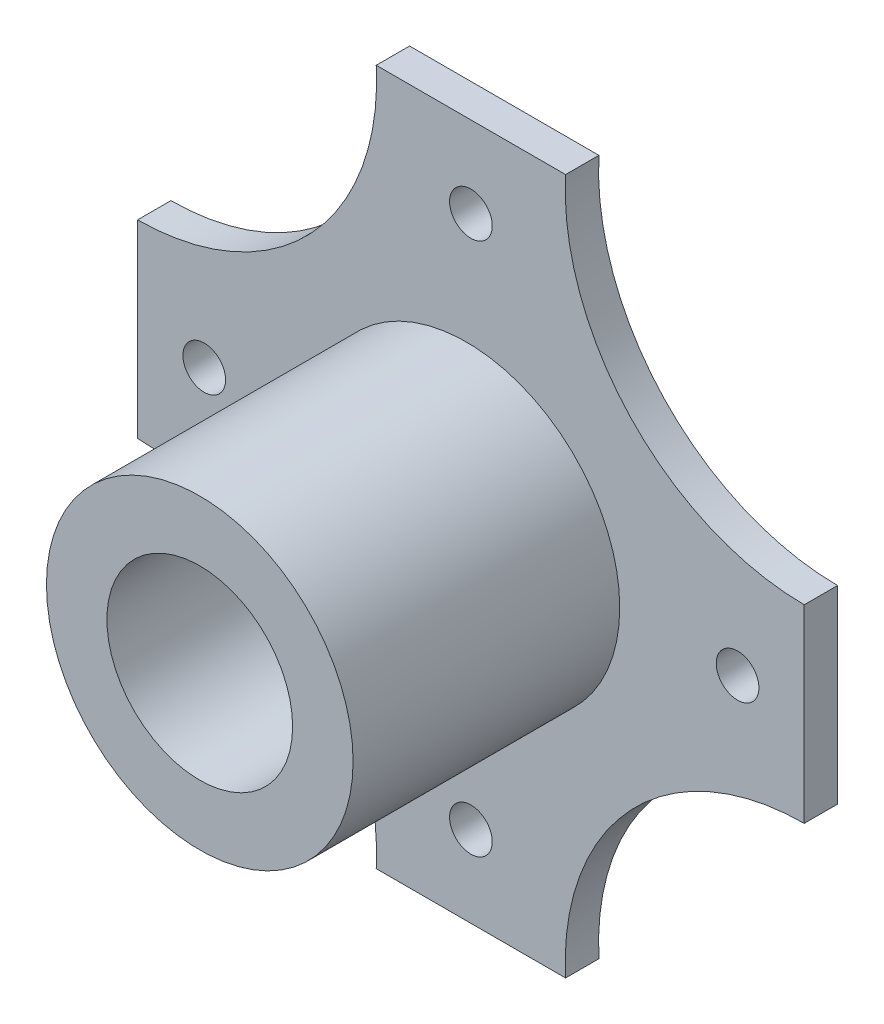
from build123d import *

# Parameters (mm, degrees)
SKETCH1_R           = 2.032
BOSS_EXTRUDE1_DEPTH = 3.175
SKETCH2_R           = 5.715
CUT_EXTRUDE1_DEPTH  = 3.175
BOSS_EXTRUDE2_START = 25.4
SKETCH3_R           = 14.605
SKETCH3_R_2         = 5.715
BOSS_EXTRUDE2_DEPTH = 25.4
SKETCH6_R           = 8.845512053
CUT_EXTRUDE3_DEPTH  = 22.225
CUT_EXTRUDE5_DEPTH  = 3.175


with BuildPart() as part:
    # Sketch1 → Boss-Extrude1 (new body)
    with BuildSketch(Plane.XY):
        with BuildLine():
            Line((0.092337824, 22.85981351), (0.092337824, 40.89418649))
            ThreePointArc((0.092337824, 40.89418649), (16.63628773, 48.075558414), (22.825148771, 65.015817568))
            Line((22.825148771, 65.015817568), (40.859521751, 65.015817568))
            ThreePointArc((40.859521751, 65.015817568), (47.048382792, 48.075558414), (63.592332697, 40.89418649))
            Line((63.592332697, 40.89418649), (63.592332697, 22.85981351))
            ThreePointArc((63.592332697, 22.85981351), (47.048382792, 15.678441586), (40.859521751, -1.261817568))
            Line((40.859521751, -1.261817568), (22.825148771, -1.261817568))
            ThreePointArc((22.825148771, -1.261817568), (16.63628773, 15.678441586), (0.092337824, 22.85981351))
        make_face()
        with Locations((6.442335261, 31.877)):
            Circle(SKETCH1_R, mode=Mode.SUBTRACT)
        with Locations((31.842335261, 57.277)):
            Circle(SKETCH1_R, mode=Mode.SUBTRACT)
        with Locations((57.242335261, 31.877)):
            Circle(SKETCH1_R, mode=Mode.SUBTRACT)
        with Locations((31.842337824, 6.477)):
            Circle(SKETCH1_R, mode=Mode.SUBTRACT)
    extrude(amount=BOSS_EXTRUDE1_DEPTH)

    # Sketch2 → Cut-Extrude1 (cut)
    with BuildSketch(Plane.XY.offset(3.175)):
        with Locations((31.415168912, 31.877)):
            Circle(SKETCH2_R)
    extrude(amount=-CUT_EXTRUDE1_DEPTH, mode=Mode.SUBTRACT)

    # Sketch3 → Boss-Extrude2 (add)
    with BuildSketch(Plane.XY.offset(3.175).offset(BOSS_EXTRUDE2_START)):
        with Locations((31.415168912, 31.877)):
            Circle(SKETCH3_R)
        with Locations((31.415168912, 31.877)):
            Circle(SKETCH3_R_2, mode=Mode.SUBTRACT)
    extrude(amount=-BOSS_EXTRUDE2_DEPTH)

    # Sketch6 → Cut-Extrude3 (cut)
    with BuildSketch(Plane.XY.offset(28.575)):
        with Locations((31.415168912, 31.877)):
            Circle(SKETCH6_R)
    extrude(amount=-CUT_EXTRUDE3_DEPTH, mode=Mode.SUBTRACT)

    # Sketch7 → Cut-Extrude5 (cut)
    with BuildSketch(Plane(origin=(0, 0, 0), x_dir=(-1, 0, 0), z_dir=(0, 0, -1))):
        Polygon((-23.056493238, 31.877), (-27.235831075, 39.115825476), (-35.594506749, 39.115825476), (-39.773844587, 31.877), (-35.594506749, 24.638174524), (-27.235831075, 24.638174524), align=None)
    extrude(amount=-CUT_EXTRUDE5_DEPTH, mode=Mode.SUBTRACT)


solid = part.part
